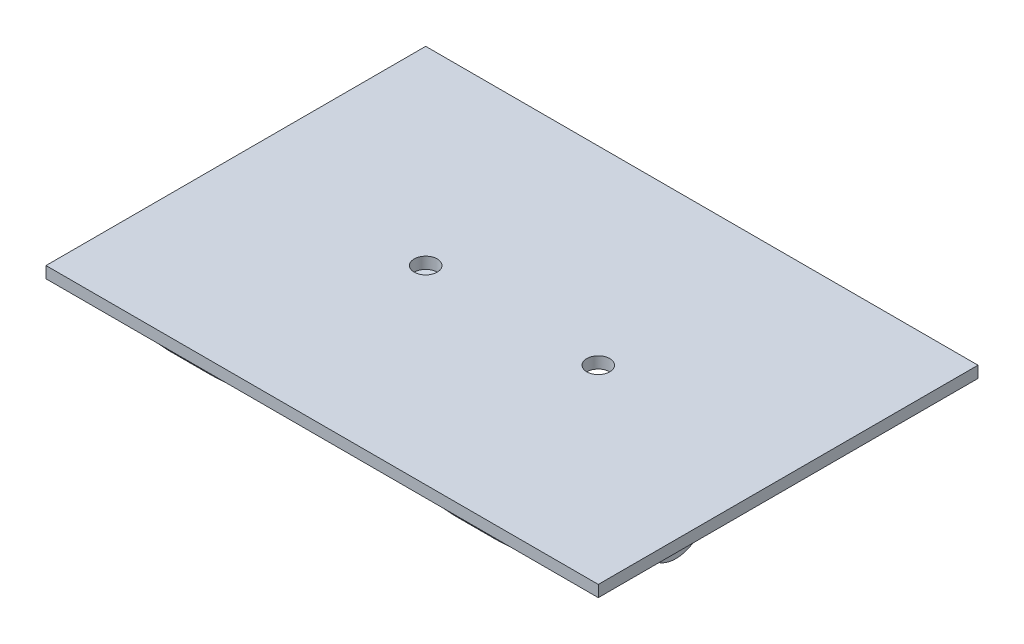
from build123d import *

# Parameters (mm, degrees)
SKETCH1_W           = 96
SKETCH1_H           = 66
SKETCH1_R           = 2
BOSS_EXTRUDE1_DEPTH = 2
SKETCH8_R           = 2.375
BOSS_EXTRUDE3_DEPTH = 7.5
SKETCH9_R           = 2.55
CUT_EXTRUDE1_DEPTH  = 7.5


with BuildPart() as part:
    # Sketch1 → Boss-Extrude1 (new body)
    with BuildSketch(Plane(origin=(0, 0, 0), x_dir=(1, 0, 0), z_dir=(0, 1, 0))):
        with Locations((48, 33)):
            Rectangle(SKETCH1_W, SKETCH1_H)
        with Locations(Location((33, 33, 0), (0, 0, 270))):
            Circle(SKETCH1_R, mode=Mode.SUBTRACT)
        with Locations(Location((63, 33, 0), (0, 0, 270))):
            Circle(SKETCH1_R, mode=Mode.SUBTRACT)
    extrude(amount=BOSS_EXTRUDE1_DEPTH)

    # Sketch8 → Boss-Extrude3 (add)
    with BuildSketch(Plane.ZY.offset(-27)):
        with BuildLine():
            Line((-8.517353084, 0), (0, 0))
            ThreePointArc((0, 0), (-12.462971529, -9.886825426), (-27.6351276, -14.670198345))
            ThreePointArc((-27.6351276, -14.670198345), (-33, -20.375), (-38.3648724, -14.670198345))
            ThreePointArc((-38.3648724, -14.670198345), (-53.537028471, -9.886825426), (-66, 0))
            Line((-66, 0), (-57.482646916, 0))
            ThreePointArc((-57.482646916, 0), (-33, -9), (-8.517353084, 0))
        make_face()
        with Locations((-33, -15)):
            Circle(SKETCH8_R, mode=Mode.SUBTRACT)
    boss_extrude3 = extrude(amount=BOSS_EXTRUDE3_DEPTH)

    # Mirror1: Boss-Extrude3 across plane
    add(boss_extrude3.mirror(Plane.ZY.offset(-48)))

    # Sketch9 → Cut-Extrude1 (cut)
    with BuildSketch(Plane(origin=(76.5, 0, 0), x_dir=(0, 0, -1), z_dir=(1, 0, 0))):
        with Locations((33, -15)):
            Circle(SKETCH9_R)
    extrude(amount=-CUT_EXTRUDE1_DEPTH, mode=Mode.SUBTRACT)


solid = part.part
